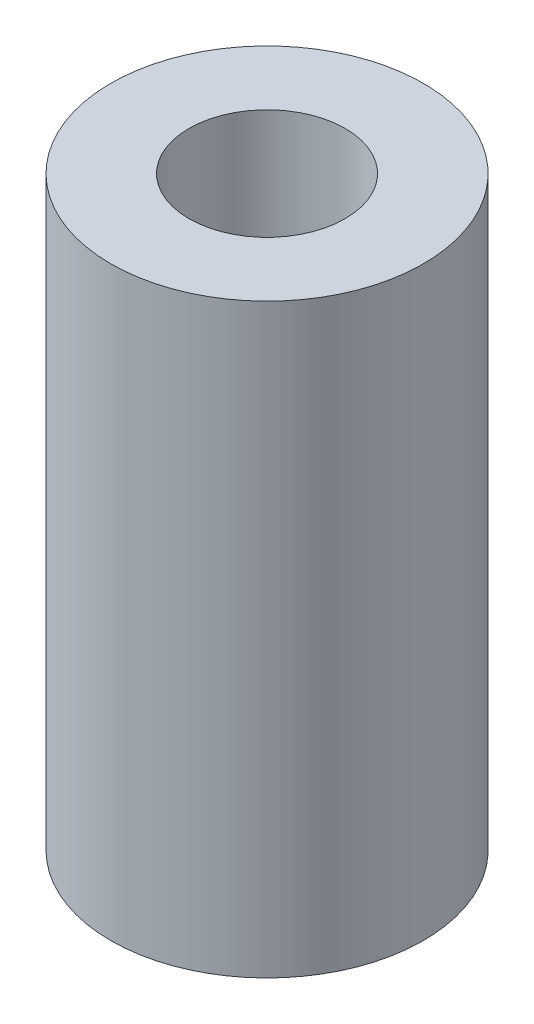
from build123d import *

# Parameters (mm, degrees)
SKETCH1_R           = 8
SKETCH1_R_2         = 4
BOSS_EXTRUDE1_DEPTH = 30


with BuildPart() as part:
    # Sketch1 → Boss-Extrude1 (new body)
    with BuildSketch(Plane(origin=(0, 0, 0), x_dir=(1, 0, 0), z_dir=(0, 1, 0))):
        with Locations(Location((0, 0, 0), (0, 0, 270))):
            Circle(SKETCH1_R)
        with Locations(Location((0, 0, 0), (0, 0, 270))):
            Circle(SKETCH1_R_2, mode=Mode.SUBTRACT)
    extrude(amount=BOSS_EXTRUDE1_DEPTH)


solid = part.part
